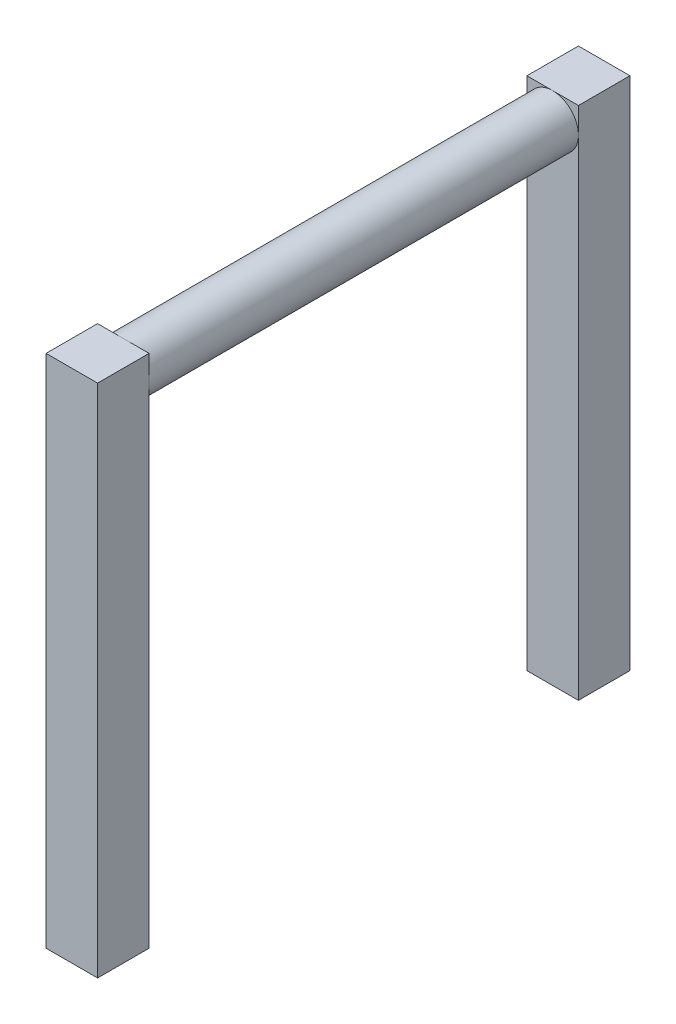
from build123d import *

# Parameters (mm, degrees)
SALIENTE_EXTRUIR1_DEPTH   = 6
SALIENTE_EXTRUIR1_2_DEPTH = 6
SALIENTE_EXTRUIR2_REACH   = 84.292
CROQUIS2_R                = 3


with BuildPart() as part:
    # Croquis1 → Saliente-Extruir1 (new body)
    with BuildSketch(Plane(origin=(0, 0, 0), x_dir=(0, 0, -1), z_dir=(1, 0, 0))):
        Polygon((56, 0), (62, 0), (62, 60), (56, 60), (56, 54), align=None)
    extrude(amount=SALIENTE_EXTRUIR1_DEPTH)


with BuildPart() as body_2:
    # Croquis1 → Saliente-Extruir1 2 (new body)
    with BuildSketch(Plane(origin=(0, 0, 0), x_dir=(0, 0, -1), z_dir=(1, 0, 0))):
        Polygon((0, 0), (6, 0), (6, 54), (6, 60), (0, 60), align=None)
    extrude(amount=SALIENTE_EXTRUIR1_2_DEPTH)

    # Croquis2 → Saliente-Extruir2 (add, up to next)
    with BuildSketch(Plane.XY.offset(-56), mode=Mode.PRIVATE) as saliente_extruir2_sk1:
        with Locations(Location((3, 57, 0), (0, 0, 180))):
            Circle(CROQUIS2_R)
    saliente_extruir2_tool1 = extrude(saliente_extruir2_sk1.sketch, amount=SALIENTE_EXTRUIR2_REACH, mode=Mode.PRIVATE) - body_2.part

    add(part.part)  # Saliente-Extruir2 merges part
    add(saliente_extruir2_tool1.solids().sort_by_distance((3, 57, -56))[0])


solid = body_2.part
